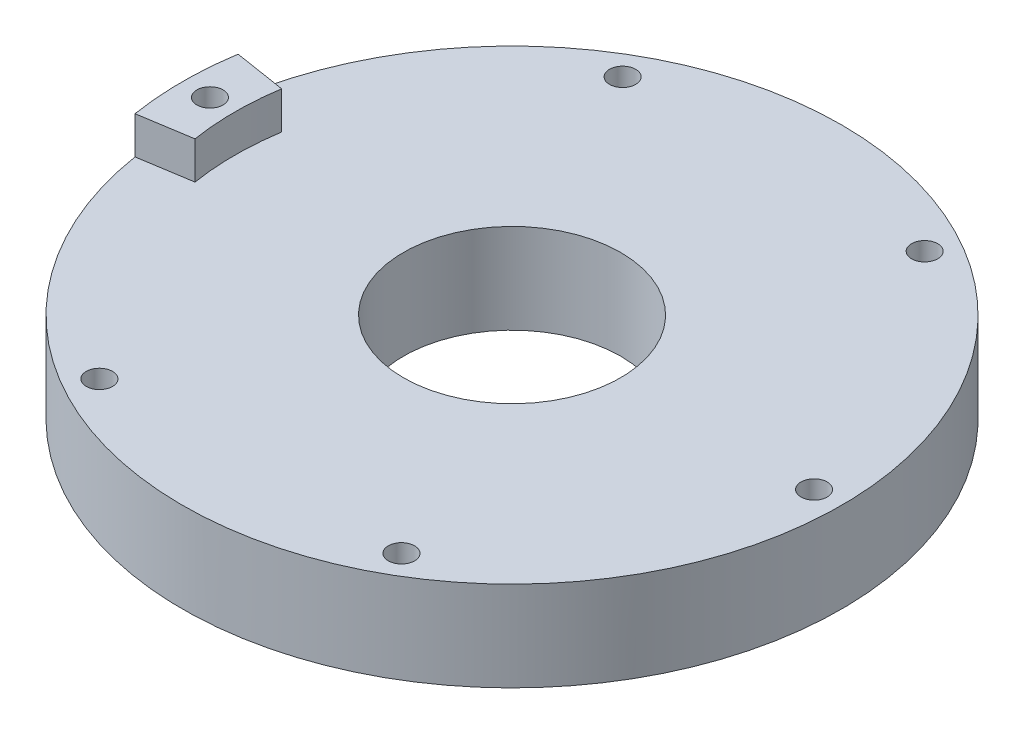
from build123d import *

# Parameters (mm, degrees)
SKETCH1_W           = 29.5
SKETCH1_H           = 12
BOSS_EXTRUDE1_START = 5
BOSS_EXTRUDE1_DEPTH = 5
SKETCH3_R           = 1.75
CUT_EXTRUDE1_DEPTH  = 65.505813691
CIRPATTERN1_COUNT   = 6


with BuildPart() as part:
    # Sketch1 → Revolve1 (revolve)
    with BuildSketch(Plane.XY, mode=Mode.PRIVATE) as revolve1_sk:
        with Locations((29.25, 6)):
            Rectangle(SKETCH1_W, SKETCH1_H)
    revolve(revolve1_sk.sketch.rotate(Axis((0, 0, 0), (0, 1, 0)), 90), axis=Axis((0, 0, 0), (0, 1, 0)))

    # Sketch2 → Boss-Extrude1 (add)
    with BuildSketch(Plane(origin=(0, 12, 0), x_dir=(1, 0, 0), z_dir=(0, 1, 0)).offset(BOSS_EXTRUDE1_START)):
        with BuildLine():
            Line((-44, 0), (-37, 0))
            ThreePointArc((-37, 0), (-36.885941348, 2.902986542), (-36.544468602, 5.788075206))
            Line((-36.544468602, 5.788075206), (-43.458286986, 6.883116462))
            ThreePointArc((-43.458286986, 6.883116462), (-43.864362684, 3.452200212), (-44, 0))
        make_face()
        with BuildLine():
            ThreePointArc((-36.544468602, -5.788075206), (-36.885941348, -2.902986542), (-37, 0))
            Line((-37, 0), (-44, 0))
            ThreePointArc((-44, 0), (-43.864362684, -3.452200212), (-43.458286986, -6.883116462))
            Line((-43.458286986, -6.883116462), (-36.544468602, -5.788075206))
        make_face()
    extrude(amount=-BOSS_EXTRUDE1_DEPTH)

    # Sketch3 → Cut-Extrude1 (cut, through all)
    with BuildSketch(Plane(origin=(0, 17, 0), x_dir=(1, 0, 0), z_dir=(0, 1, 0))):
        with Locations(Location((-40.332863527, 0, 0), (0, 0, 270))):
            Circle(SKETCH3_R)
    cut_extrude1 = extrude(amount=-CUT_EXTRUDE1_DEPTH, mode=Mode.SUBTRACT)

    # CirPattern1: Cut-Extrude1 ×6 about axis
    cirpattern1_axis = Axis((0, 0, 0), (0, 1, 0))
    for i in range(1, CIRPATTERN1_COUNT):
        add(cut_extrude1.rotate(cirpattern1_axis, i * 360 / CIRPATTERN1_COUNT), mode=Mode.SUBTRACT)


solid = part.part
